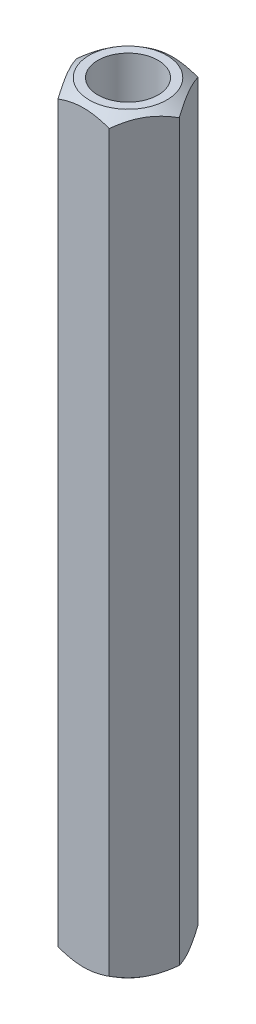
from build123d import *

# Parameters (mm, degrees)
SKETCH_1_R      = 2
EXTRUDE_1_DEPTH = 50


with BuildPart() as part:
    # 草图1 → 凸台-拉伸1 (new body)
    with BuildSketch(Plane(origin=(0, 0, 0), x_dir=(1, 0, 0), z_dir=(0, 1, 0))):
        Polygon((1.703183294, -2.95), (3.406366588, 0), (1.703183294, 2.95), (-1.703183294, 2.95), (-3.406366588, 0), (-1.703183294, -2.95), align=None)
        with Locations(Location((0, 0, 0), (0, 0, 270))):
            Circle(SKETCH_1_R, mode=Mode.SUBTRACT)
    extrude(amount=EXTRUDE_1_DEPTH)

    # 草图3 → 切除-旋转1 (revolve, cut)
    with BuildSketch(Plane.XY, mode=Mode.PRIVATE) as cut_revolve_1_sk:
        Polygon((6.978635767, 3.2), (1.2, -1), (6.978635767, -1), align=None)
    cut_revolve_1 = revolve(cut_revolve_1_sk.sketch.rotate(Axis((0, 59.182101856, 0), (0, -1, 0)), 90), axis=Axis((0, 59.182101856, 0), (0, -1, 0)), mode=Mode.SUBTRACT)

    # 镜向1: 切除-旋转1 across plane
    add(cut_revolve_1.mirror(Plane.ZX.offset(25)), mode=Mode.SUBTRACT)


solid = part.part
